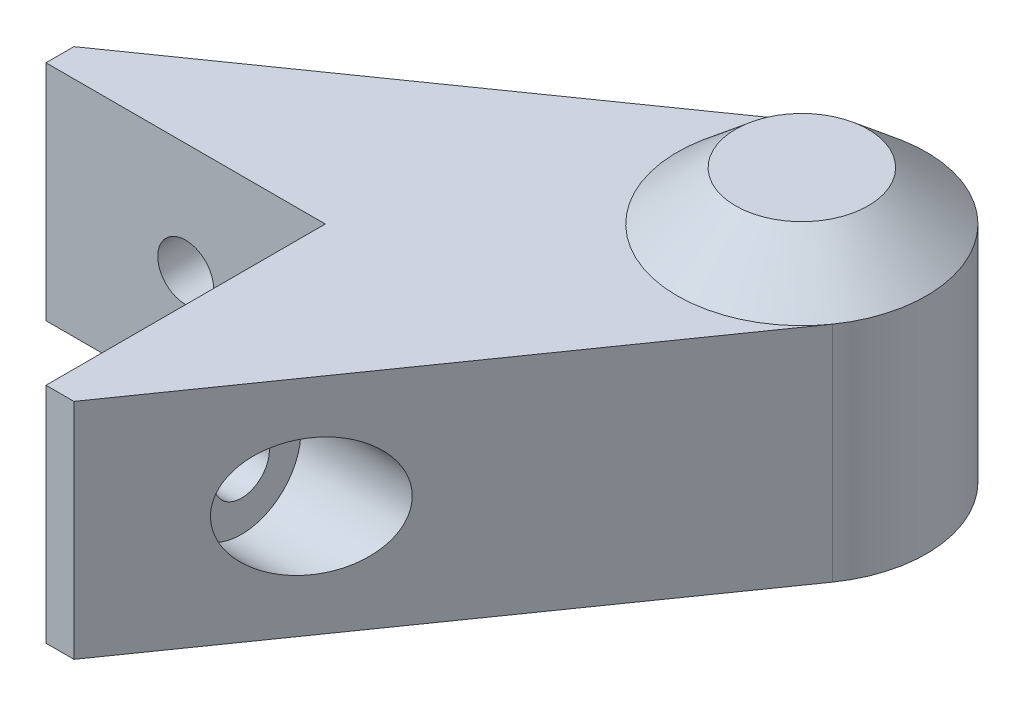
from build123d import *

# Parameters (mm, degrees)
BOSS_EXTRUDE1_DEPTH = 16
SKETCH10_R          = 8.9195787
BOSS_EXTRUDE8_DEPTH = 3.5
BOSS_EXTRUDE8_TAPER = 50
SKETCH12_R          = 2
CUT_EXTRUDE3_DEPTH  = 48.178799534
CUT_EXTRUDE4_START  = -4
SKETCH13_R          = 4.25
CUT_EXTRUDE4_DEPTH  = 44.178799534


with BuildPart() as part:
    # Sketch1 → Boss-Extrude1 (new body)
    with BuildSketch(Plane(origin=(0, 0, 0), x_dir=(1, 0, 0), z_dir=(0, 1, 0))):
        with BuildLine():
            Line((-10, 10), (10, 10))
            Line((10, 10), (10, -10))
            Line((10, -10), (12, -10))
            Line((12, -10), (34.369481018, 21.946929727))
            ThreePointArc((34.369481018, 21.946929727), (33.370084476, 33.370084476), (21.946929727, 34.369481018))
            Line((21.946929727, 34.369481018), (-10, 12))
            Line((-10, 12), (-10, 10))
        make_face()
    extrude(amount=-BOSS_EXTRUDE1_DEPTH)

    # Sketch10 → Boss-Extrude8 (add)
    with BuildSketch(Plane(origin=(0, 0, 0), x_dir=(1, 0, 0), z_dir=(0, 1, 0))):
        with Locations((27.062989892, 27.062989892)):
            Circle(SKETCH10_R)
    extrude(amount=BOSS_EXTRUDE8_DEPTH, taper=BOSS_EXTRUDE8_TAPER)

    # Sketch12 → Cut-Extrude3 (cut, through all)
    with BuildSketch(Plane.ZY.offset(-10)):
        with Locations((0, -8)):
            Circle(SKETCH12_R)
    cut_extrude3 = extrude(amount=-CUT_EXTRUDE3_DEPTH, mode=Mode.SUBTRACT)

    # Sketch13 → Cut-Extrude4 (cut, through all)
    with BuildSketch(Plane.ZY.offset(-10).offset(CUT_EXTRUDE4_START)):
        with Locations((0, -8)):
            Circle(SKETCH13_R)
    cut_extrude4 = extrude(amount=-CUT_EXTRUDE4_DEPTH, mode=Mode.SUBTRACT)

    # Mirror3: Cut-Extrude3, Cut-Extrude4 across plane
    add(cut_extrude3.mirror(Plane(origin=(0, 0, 0), x_dir=(-0.7071067811865478, 0, 0.7071067811865472), z_dir=(-0.7071067811865475, 0, -0.7071067811865477))), mode=Mode.SUBTRACT)
    add(cut_extrude4.mirror(Plane(origin=(0, 0, 0), x_dir=(-0.7071067811865478, 0, 0.7071067811865472), z_dir=(-0.7071067811865475, 0, -0.7071067811865477))), mode=Mode.SUBTRACT)


solid = part.part
